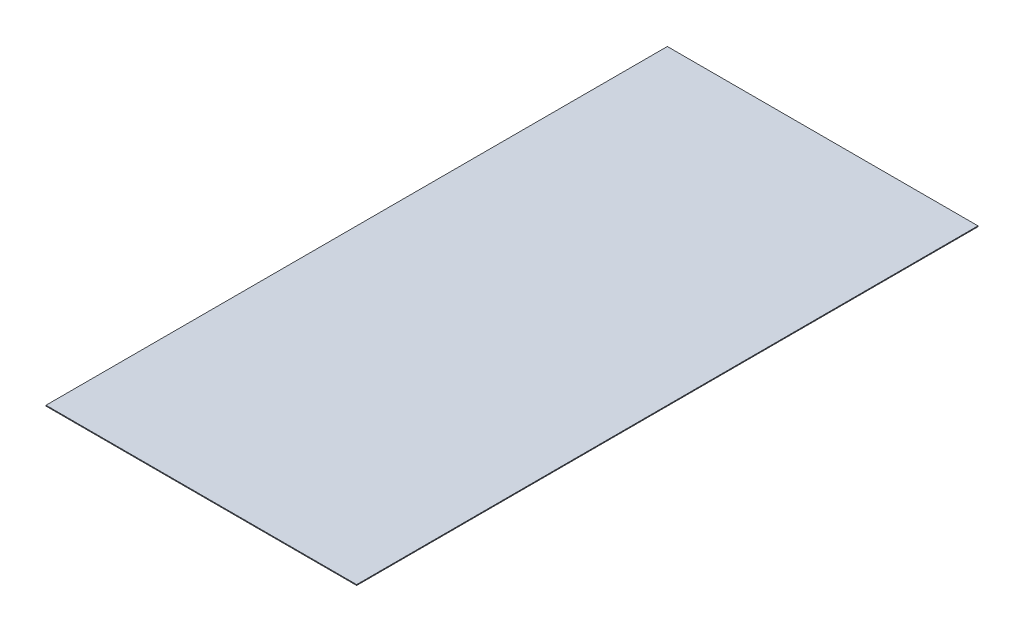
from build123d import *

# Parameters (mm, degrees)
CROQUIS1_W              = 1219.2
CROQUIS1_H              = 2438.4
SALIENTE_EXTRUIR1_DEPTH = 3.2


with BuildPart() as part:
    # Croquis1 → Saliente-Extruir1 (new body)
    with BuildSketch(Plane(origin=(0, 0, 0), x_dir=(1, 0, 0), z_dir=(0, 1, 0))):
        Rectangle(CROQUIS1_W, CROQUIS1_H)
    extrude(amount=SALIENTE_EXTRUIR1_DEPTH)


solid = part.part
